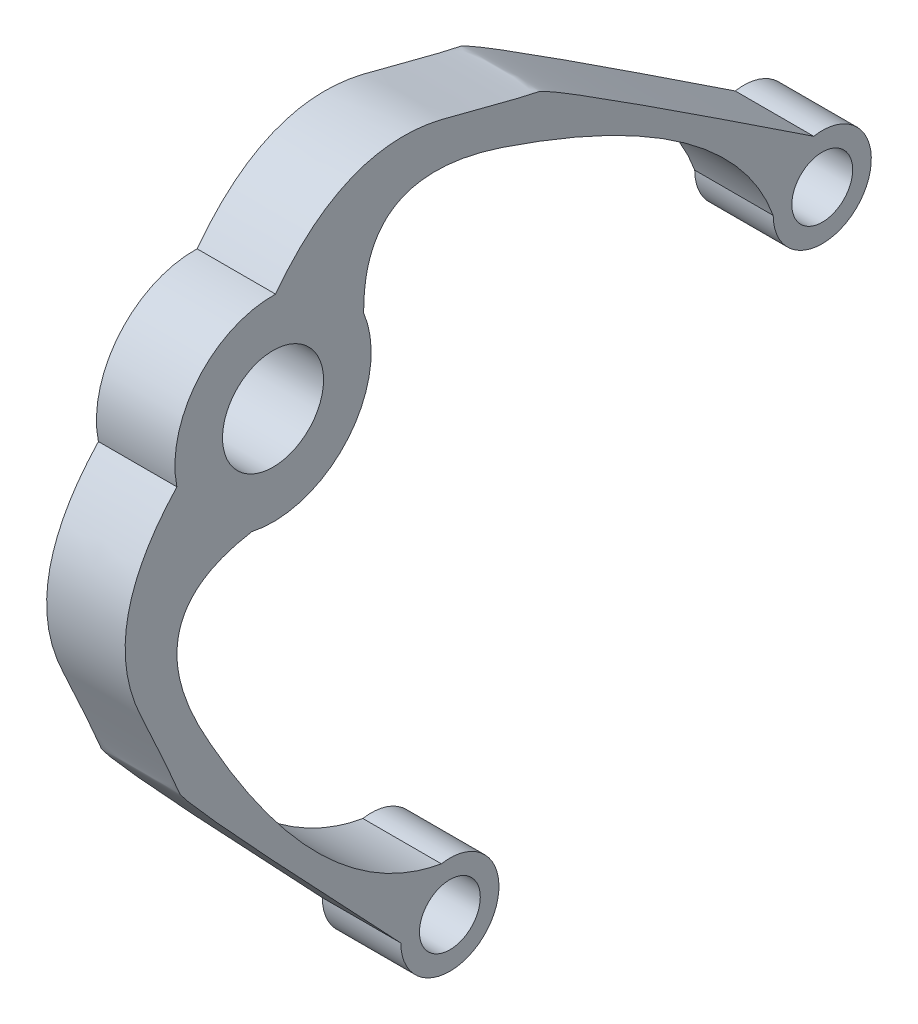
from build123d import *

# Parameters (mm, degrees)
SKETCH_1_R      = 5
SKETCH_1_R_2    = 2.575
EXTRUDE_1_DEPTH = 4
SKETCH_2_R      = 1.55
EXTRUDE_2_DEPTH = 4


with BuildPart() as part:
    # 草图1 → 凸台-拉伸1 (new body)
    with BuildSketch(Plane(origin=(0, 0, 0), x_dir=(0, 0, -1), z_dir=(1, 0, 0))):
        Circle(SKETCH_1_R)
        Circle(SKETCH_1_R_2, mode=Mode.SUBTRACT)
    extrude(amount=EXTRUDE_1_DEPTH)

    # 草图2 → 凸台-拉伸2 (add)
    # profile 1 of 2: a face of its own
    with BuildSketch(Plane.ZY):
        with BuildLine():
            Line((-0.127886673, 4.998364232), (-4.649231706, 1.839740347))
            ThreePointArc((-4.649231706, 1.839740347), (-4.634403006, 1.876781494), (-4.619279199, 1.913703132))
            add(Edge.make_bspline(
                [(-4.619279199, 1.913703132), (-4.562458027, 8.112413093), (-23.35589572, 1.733060959), (-25.489571125, -4.210748876)],
                knots=[0, 0, 0, 0.386205631, 1, 1, 1], degree=2))
            ThreePointArc((-25.489571125, -4.210748876), (-29.904822139, -5.817551153), (-27.55502197, -1.748805125))
            add(Edge.make_bspline(
                [(-0.127886673, 4.998364232), (-3.719458123, 9.77498219), (-12.729817731, 7.374971215), (-14.210505255, 7.104549869), (-27.55502197, -1.748805125)],
                knots=[0, 0, 0, 0.416313068, 0.733125741, 1, 1, 1], degree=2))
        make_face()
        with Locations((-27.989571125, -4.210748876)):
            Circle(SKETCH_2_R, mode=Mode.SUBTRACT)
    # profile 2 of 2: a face of its own
    with BuildSketch(Plane.ZY):
        with BuildLine():
            Line((4.900047416, -0.9947539), (1.003607016, -4.898241823))
            ThreePointArc((1.003607016, -4.898241823), (1.042661824, -4.890077333), (1.081650238, -4.881601455))
            add(Edge.make_bspline(
                [(1.081650238, -4.881601455), (7.195876975, -5.903102913), (-2.353034462, -23.301600674), (-8.577239391, -24.36964519)],
                knots=[0, 0, 0, 0.386205631, 1, 1, 1], degree=2))
            ThreePointArc((-8.577239391, -24.36964519), (-10.927039559, -28.438391217), (-6.511788546, -26.831588941))
            add(Edge.make_bspline(
                [(4.900047416, -0.9947539), (8.979667573, -5.361922773), (5.050013102, -13.817953089), (4.52633564, -15.229096301), (-6.511788546, -26.831588941)],
                knots=[0, 0, 0, 0.416313068, 0.733125741, 1, 1, 1], degree=2))
        make_face()
        with Locations(Location((-9.011788546, -26.831588941, 0), (0, 0, 180))):
            Circle(SKETCH_2_R, mode=Mode.SUBTRACT)
    extrude(amount=-EXTRUDE_2_DEPTH)


solid = part.part
